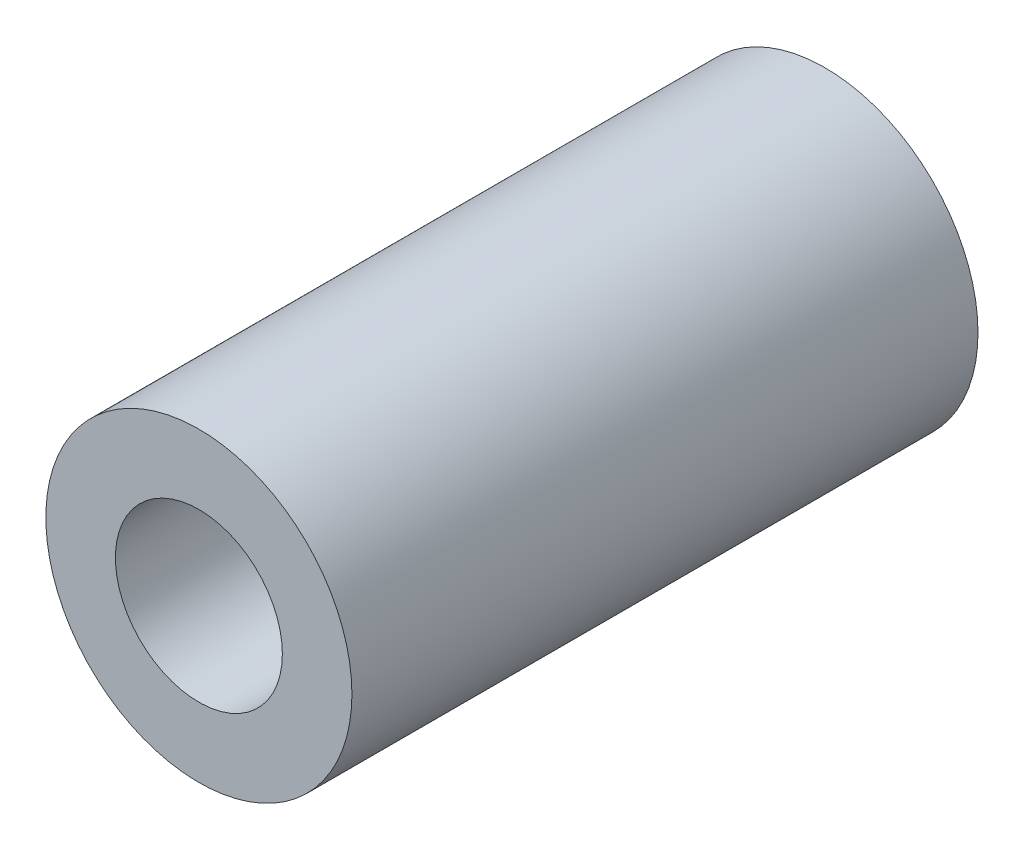
from build123d import *

# Parameters (mm, degrees)
SKETCH_1_R      = 2.2
SKETCH_1_R_2    = 1.2
EXTRUDE_1_DEPTH = 9


with BuildPart() as part:
    # Эскиз1 → Бобышка-Вытянуть1 (new body)
    with BuildSketch(Plane.XY):
        Circle(SKETCH_1_R)
        Circle(SKETCH_1_R_2, mode=Mode.SUBTRACT)
    extrude(amount=EXTRUDE_1_DEPTH)


solid = part.part
